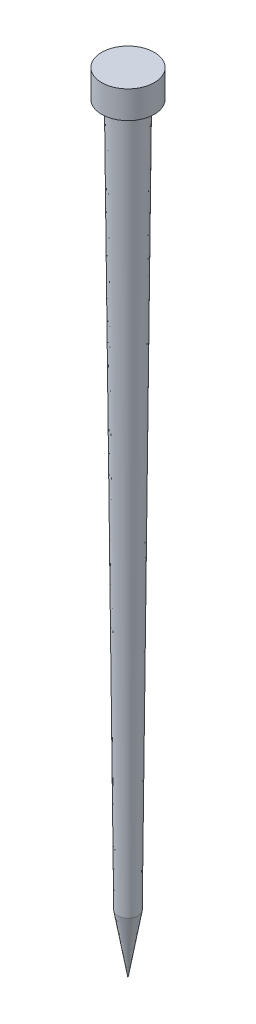
from build123d import *


with BuildPart() as part:
    # Sketch2 → Revolve1 (revolve)
    with BuildSketch(Plane.XY, mode=Mode.PRIVATE) as revolve1_sk:
        Polygon((0, -23.314098837), (0.328639165, -21.401279124), (0.488343488, -20.47173204), (0.807595173, 13.456831395), (1.27, 13.456831395), (1.27, 14.785901163), (0, 14.785901163), align=None)
    revolve(revolve1_sk.sketch.rotate(Axis((0, 14.785901163, 0), (0, -1, 0)), 90), axis=Axis((0, 14.785901163, 0), (0, -1, 0)))


solid = part.part
